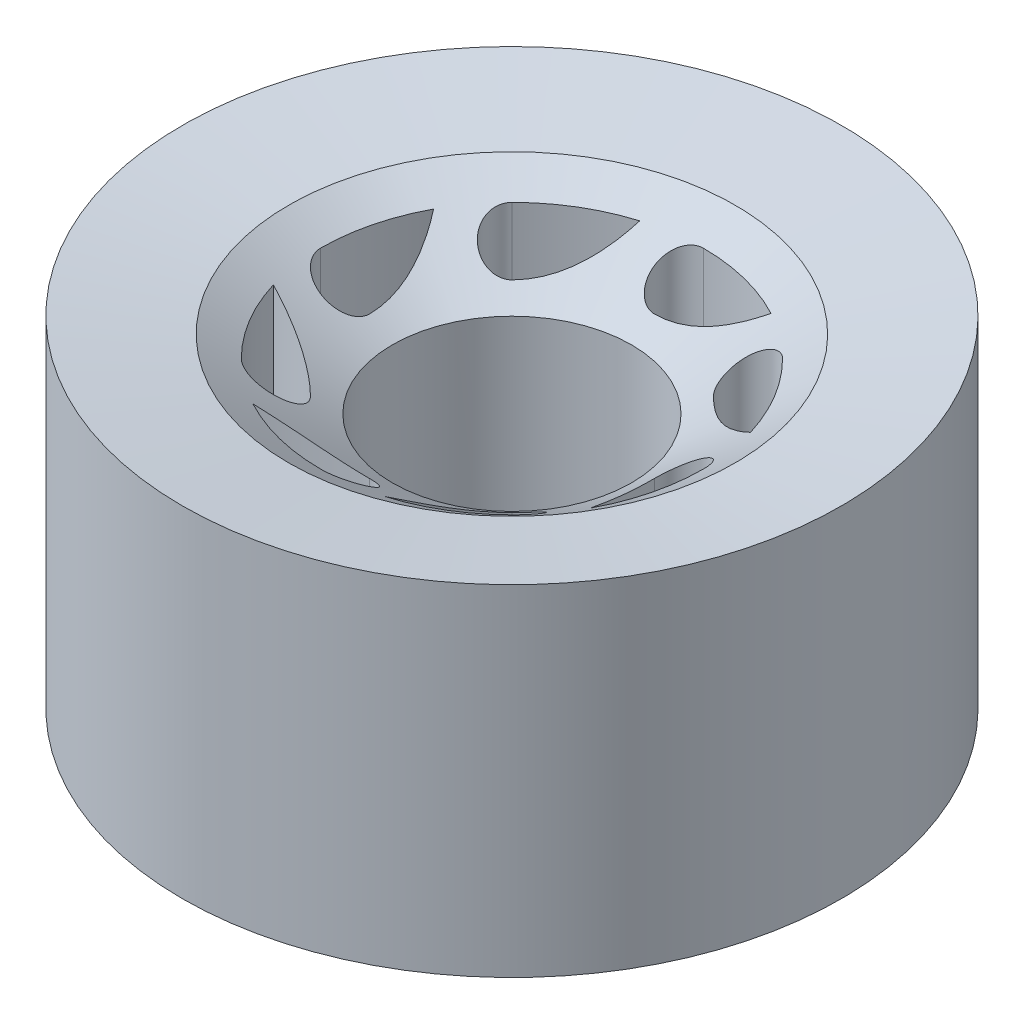
from build123d import *

# Parameters (mm, degrees)
SKETCH_5_R          = 4
CUT_EXTRUDE_1_DEPTH = 55.27706698
CUT_EXTRUDE_2_DEPTH = 55.27706698
SKETCH_8_R          = 11.25
CUT_EXTRUDE_3_DEPTH = 55.27706698


with BuildPart() as part:
    # 草图3 → 旋转1 (revolve)
    with BuildSketch(Plane(origin=(0, 0, 0), x_dir=(0, 0, -1), z_dir=(1, 0, 0)), mode=Mode.PRIVATE) as revolve_1_sk:
        Polygon((0, 211.239142824), (11.25, 211.239142824), (21, 217.739142824), (31, 219.239142824), (31, 187.239142824), (0, 187.239142824), align=None)
    revolve(revolve_1_sk.sketch.rotate(Axis((0, 291.944884017, 0), (0, -1, 0)), 180), axis=Axis((0, 291.944884017, 0), (0, -1, 0)))

    # 草图5 → 切除-拉伸1 (cut, through all)
    with BuildSketch(Plane.XZ.offset(-187.239142824)):
        with Locations(Location((0, 0, 0), (0, 0, 270))):
            Circle(SKETCH_5_R)
    extrude(amount=-CUT_EXTRUDE_1_DEPTH, mode=Mode.SUBTRACT)

    # 草图6 → 切除-拉伸2 (cut, through all)
    with BuildSketch(Plane.XZ.offset(-187.239142824)):
        with BuildLine():
            ThreePointArc((-12.727922061, 12.727922061), (-9.475230868, 12.727922061), (-9.475230868, 9.475230868))
            ThreePointArc((-9.475230868, 9.475230868), (-13.048964597, 6.79154607), (-17.229268429, 5.210787791))
            ThreePointArc((-17.229268429, 5.210787791), (-15.442964172, 9.247424375), (-12.727922061, 12.727922061))
        make_face()
        with BuildLine():
            ThreePointArc((0, 18), (2.3, 15.7), (0, 13.4))
            ThreePointArc((0, 13.4), (-4.424663073, 14.029359635), (-8.498349158, 15.867515924))
            ThreePointArc((-8.498349158, 15.867515924), (-4.380908204, 17.458741172), (0, 18))
        make_face()
        with BuildLine():
            ThreePointArc((12.727922061, 12.727922061), (12.727922061, 9.475230868), (9.475230868, 9.475230868))
            ThreePointArc((9.475230868, 9.475230868), (6.79154607, 13.048964597), (5.210787791, 17.229268429))
            ThreePointArc((5.210787791, 17.229268429), (9.247424375, 15.442964172), (12.727922061, 12.727922061))
        make_face()
        with BuildLine():
            ThreePointArc((18, 0), (15.7, -2.3), (13.4, 0))
            ThreePointArc((13.4, 0), (14.029359635, 4.424663073), (15.867515924, 8.498349158))
            ThreePointArc((15.867515924, 8.498349158), (17.458741172, 4.380908204), (18, 0))
        make_face()
        with BuildLine():
            ThreePointArc((12.727922061, -12.727922061), (9.475230868, -12.727922061), (9.475230868, -9.475230868))
            ThreePointArc((9.475230868, -9.475230868), (13.048964597, -6.79154607), (17.229268429, -5.210787791))
            ThreePointArc((17.229268429, -5.210787791), (15.442964172, -9.247424375), (12.727922061, -12.727922061))
        make_face()
        with BuildLine():
            ThreePointArc((0, -18), (-2.3, -15.7), (0, -13.4))
            ThreePointArc((0, -13.4), (4.424663073, -14.029359635), (8.498349158, -15.867515924))
            ThreePointArc((8.498349158, -15.867515924), (4.380908204, -17.458741172), (0, -18))
        make_face()
        with BuildLine():
            ThreePointArc((-12.727922061, -12.727922061), (-12.727922061, -9.475230868), (-9.475230868, -9.475230868))
            ThreePointArc((-9.475230868, -9.475230868), (-6.79154607, -13.048964597), (-5.210787791, -17.229268429))
            ThreePointArc((-5.210787791, -17.229268429), (-9.247424375, -15.442964172), (-12.727922061, -12.727922061))
        make_face()
        with BuildLine():
            ThreePointArc((-13.4, 0), (-14.029359635, -4.424663073), (-15.867515924, -8.498349158))
            ThreePointArc((-15.867515924, -8.498349158), (-17.458741172, -4.380908204), (-18, 0))
            ThreePointArc((-18, 0), (-15.7, 2.3), (-13.4, 0))
        make_face()
    extrude(amount=-CUT_EXTRUDE_2_DEPTH, mode=Mode.SUBTRACT)

    # 草图8 → 切除-拉伸3 (cut, through all)
    with BuildSketch(Plane.XZ.offset(-187.239142824)):
        with Locations(Location((0, 0, 0), (0, 0, 270))):
            Circle(SKETCH_8_R)
    extrude(amount=-CUT_EXTRUDE_3_DEPTH, mode=Mode.SUBTRACT)


solid = part.part
